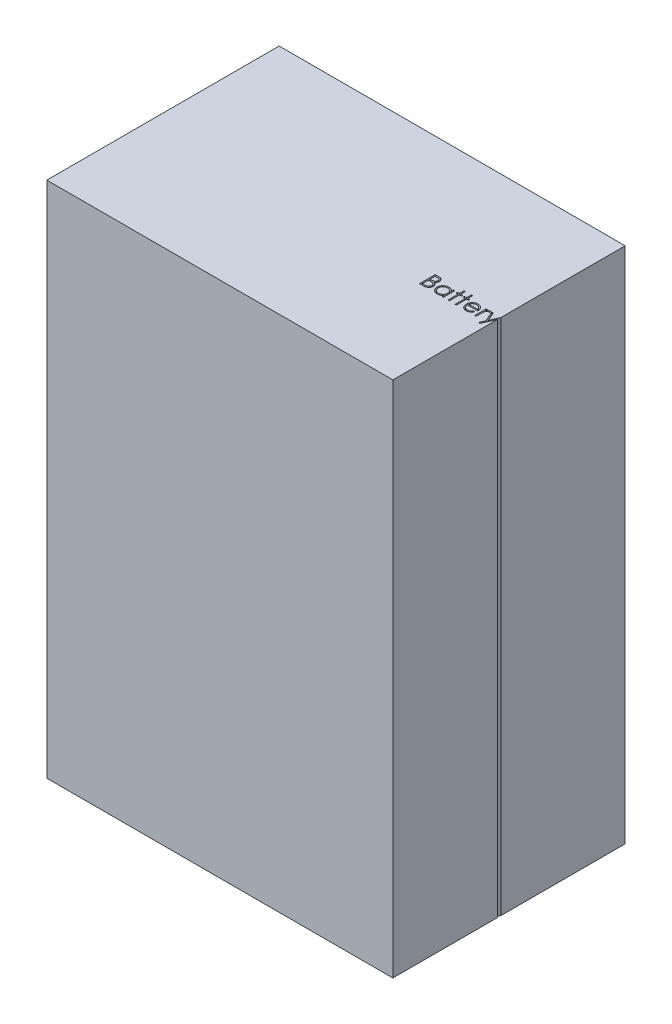
from build123d import *

# Parameters (mm, degrees)
SKETCH1_W      = 70
SKETCH1_H      = 104.788679932
EXTRUDE1_DEPTH = 23.5
EXTRUDE2_DEPTH = 113.950951487


with BuildPart() as part:
    # Sketch1 → Extrude1 (new, symmetric)
    with BuildSketch(Plane.XY):
        Rectangle(SKETCH1_W, SKETCH1_H)
    extrude(amount=EXTRUDE1_DEPTH, both=True)

    # Sketch2 → Extrude2 (cut, through all)
    # profile 1 of 7: a face of its own
    with BuildSketch(Plane(origin=(0, 52.394339966, 0), x_dir=(1, 0, 0), z_dir=(0, 1, 0))):
        with BuildLine():
            Line((20.83761968, -0.759237165), (21.45710085, -0.759237165))
            add(Edge.make_bspline(
                [(21.45710085, -0.759237165), (21.487425255, -0.759396596), (21.546201499, -0.759705612), (21.631671993, -0.764498167), (21.711726271, -0.771032924), (21.78638755, -0.781401651), (21.85562133, -0.793912763), (21.919636258, -0.809063696), (21.978228772, -0.827230696), (22.04818104, -0.856119823), (22.127937639, -0.899048697), (22.214296181, -0.962483895), (22.288141456, -1.040074058), (22.351810472, -1.12759761), (22.402430059, -1.223877917), (22.439050779, -1.326620181), (22.462235423, -1.43449919), (22.464619788, -1.508561216), (22.465824808, -1.545990971)],
                knots=[0, 0, 0, 0, 1.001505555, 1.941167018, 2.826882275, 3.653841531, 4.429895133, 5.150066043, 5.825578002, 6.45369114, 7.647487171, 8.808567382, 9.977351308, 11.170798116, 12.373658725, 13.556498008, 14.765093433, 16, 16, 16, 16], degree=3))
            add(Edge.make_bspline(
                [(22.465824808, -1.545990971), (22.464833103, -1.581054361), (22.462884308, -1.649957228), (22.444249091, -1.750735456), (22.41507477, -1.846666919), (22.374520723, -1.937401511), (22.321813912, -2.020889146), (22.25934958, -2.097803309), (22.183987052, -2.164887482), (22.127523541, -2.202391401), (22.098842636, -2.221441692)],
                knots=[0, 0, 0, 0, 1.044552857, 2.05264487, 3.044412934, 4.028983338, 5.005914585, 5.980388656, 6.974128949, 8, 8, 8, 8], degree=3))
            add(Edge.make_bspline(
                [(22.098842636, -2.221441692), (22.134911024, -2.235289227), (22.203918785, -2.261782991), (22.298883954, -2.308623733), (22.380703563, -2.359570791), (22.450006688, -2.41520754), (22.509277275, -2.475177676), (22.561032444, -2.54036053), (22.605193404, -2.611606403), (22.643032985, -2.688172467), (22.672559357, -2.769276906), (22.694671784, -2.854158967), (22.707342256, -2.942514278), (22.709145331, -3.002644587), (22.710055577, -3.033000186)],
                knots=[0, 0, 0, 0, 1.27268992, 2.434971085, 3.483601985, 4.442670788, 5.356604649, 6.2567628, 7.179492994, 8.113709626, 9.066344395, 10.018646069, 10.999752585, 12, 12, 12, 12], degree=3))
            add(Edge.make_bspline(
                [(22.710055577, -3.033000186), (22.709169438, -3.06399442), (22.707425935, -3.124976443), (22.694562675, -3.214561458), (22.672782985, -3.300173017), (22.642782731, -3.382364861), (22.603628346, -3.460977983), (22.555977978, -3.536101444), (22.499162202, -3.606980444), (22.435605171, -3.674402588), (22.363703082, -3.735024938), (22.286128076, -3.789014186), (22.2019032, -3.833415257), (22.112411748, -3.870713362), (22.016649833, -3.899204178), (21.915047468, -3.919136441), (21.80769228, -3.932566725), (21.734023434, -3.933670903), (21.696243478, -3.934237165)],
                knots=[0, 0, 0, 0, 0.978564426, 1.925352924, 2.850884081, 3.763762016, 4.682927383, 5.618979971, 6.567305752, 7.547517671, 8.540179244, 9.531824382, 10.526200242, 11.540722885, 12.589160233, 13.674978461, 14.80764778, 16, 16, 16, 16], degree=3))
            Line((21.696243478, -3.934237165), (20.83761968, -3.934237165))
            Line((20.83761968, -3.934237165), (20.83761968, -0.759237165))
        make_face()
        with BuildLine():
            Line((21.122555577, -1.08487819), (21.122555577, -2.102506396))
            Line((21.122555577, -2.102506396), (21.313996883, -2.102506396))
            add(Edge.make_bspline(
                [(21.313996883, -2.102506396), (21.341981148, -2.102143608), (21.396052449, -2.101442629), (21.474356927, -2.099434653), (21.547041765, -2.093812142), (21.613981499, -2.088191247), (21.675070716, -2.079052157), (21.730174076, -2.068173589), (21.780156375, -2.056668382), (21.83779582, -2.037101776), (21.90317628, -2.00818417), (21.972874882, -1.963306148), (22.034319722, -1.909853342), (22.086205742, -1.848175826), (22.128670433, -1.780261501), (22.158165018, -1.707193973), (22.178165054, -1.630794282), (22.179971658, -1.578344867), (22.18088891, -1.55171513)],
                knots=[0, 0, 0, 0, 1.156816544, 2.235205308, 3.236616184, 4.169592532, 5.011045266, 5.787822928, 6.49130361, 7.128639758, 8.301311294, 9.436451833, 10.541879658, 11.654887649, 12.756523258, 13.837046038, 14.901820046, 16, 16, 16, 16], degree=3))
            add(Edge.make_bspline(
                [(22.18088891, -1.55171513), (22.18041159, -1.53409318), (22.179475273, -1.499525801), (22.17180692, -1.449134601), (22.158773478, -1.401742054), (22.142032797, -1.356698682), (22.118638773, -1.315412933), (22.091094774, -1.276457319), (22.057815612, -1.241158469), (22.019935764, -1.208166138), (21.976385085, -1.178915745), (21.927189556, -1.153297339), (21.871683592, -1.132668206), (21.810802645, -1.11460141), (21.743609587, -1.101912029), (21.670879813, -1.091340742), (21.592017604, -1.085958897), (21.537457404, -1.085246461), (21.509254295, -1.08487819)],
                knots=[0, 0, 0, 0, 0.91205012, 1.789085906, 2.630437955, 3.453916878, 4.269457761, 5.079663411, 5.91843418, 6.774407191, 7.675494373, 8.627863946, 9.638891023, 10.736472738, 11.911756761, 13.175263542, 14.539845004, 16, 16, 16, 16], degree=3))
            Line((21.509254295, -1.08487819), (21.122555577, -1.08487819))
        make_face(mode=Mode.SUBTRACT)
        with BuildLine():
            Line((21.122555577, -2.428147421), (21.122555577, -3.608596139))
            Line((21.122555577, -3.608596139), (21.528334824, -3.608596139))
            add(Edge.make_bspline(
                [(21.528334824, -3.608596139), (21.557380564, -3.608248025), (21.613362398, -3.607577082), (21.694189943, -3.605386736), (21.769104616, -3.600404458), (21.837764567, -3.592561437), (21.900911192, -3.584053844), (21.957786966, -3.57261361), (22.008852934, -3.559506339), (22.068066056, -3.539246054), (22.134744239, -3.507771398), (22.206599801, -3.460314921), (22.270486442, -3.403778778), (22.324738356, -3.338345734), (22.369200138, -3.267197316), (22.401544729, -3.191772606), (22.421493578, -3.113317878), (22.423908546, -3.059826646), (22.42511968, -3.033000186)],
                knots=[0, 0, 0, 0, 1.160039823, 2.235823828, 3.228722157, 4.157150951, 4.99529583, 5.772374946, 6.472645482, 7.099169577, 8.269452708, 9.405989375, 10.527446681, 11.663510218, 12.788923519, 13.866172445, 14.929861265, 16, 16, 16, 16], degree=3))
            add(Edge.make_bspline(
                [(22.42511968, -3.033000186), (22.424869214, -3.016224084), (22.424372322, -2.98294248), (22.416878764, -2.93403313), (22.405980468, -2.886656802), (22.391891238, -2.840684852), (22.37137215, -2.796948432), (22.347417642, -2.754582539), (22.319331227, -2.713531168), (22.275566877, -2.661631481), (22.211910862, -2.601835334), (22.121462573, -2.543290599), (22.018617703, -2.496075803), (21.94402562, -2.476028421), (21.905493277, -2.465672461)],
                knots=[0, 0, 0, 0, 0.723448775, 1.435228256, 2.130040452, 2.821711965, 3.505591119, 4.210454504, 4.921174351, 5.648778258, 7.137944449, 8.670945889, 10.280296675, 12, 12, 12, 12], degree=3))
            add(Edge.make_bspline(
                [(21.905493277, -2.465672461), (21.890045455, -2.462538207), (21.856551389, -2.455742496), (21.801934512, -2.448569079), (21.73958126, -2.442178203), (21.66934765, -2.437450939), (21.591144822, -2.432564574), (21.504805761, -2.430664272), (21.410683054, -2.428397086), (21.345375687, -2.428232772), (21.311452813, -2.428147421)],
                knots=[0, 0, 0, 0, 0.634451884, 1.375622551, 2.216452059, 3.157844607, 4.20941857, 5.370758133, 6.634282058, 8, 8, 8, 8], degree=3))
            Line((21.311452813, -2.428147421), (21.122555577, -2.428147421))
        make_face(mode=Mode.SUBTRACT)
    # profile 2 of 7: a face of its own
    with BuildSketch(Plane(origin=(0, 52.394339966, 0), x_dir=(1, 0, 0), z_dir=(0, 1, 0))):
        with BuildLine():
            Line((25.640824808, -1.614044857), (25.640824808, -3.934237165))
            Line((25.640824808, -3.934237165), (25.35588891, -3.934237165))
            Line((25.35588891, -3.934237165), (25.35588891, -3.532910041))
            add(Edge.make_bspline(
                [(25.35588891, -3.532910041), (25.323759008, -3.569231673), (25.261057098, -3.640113794), (25.156335512, -3.732716908), (25.045330094, -3.809260099), (24.92857961, -3.871081809), (24.806189489, -3.917520317), (24.678431038, -3.950527761), (24.545252143, -3.971749312), (24.454308935, -3.973868417), (24.408222644, -3.974942293)],
                knots=[0, 0, 0, 0, 1.074387032, 2.096679803, 3.090159297, 4.057316773, 5.018401886, 5.985159533, 6.978961417, 8, 8, 8, 8], degree=3))
            add(Edge.make_bspline(
                [(24.408222644, -3.974942293), (24.367248858, -3.973829798), (24.286446736, -3.971635909), (24.167584645, -3.954615819), (24.053200961, -3.927283041), (23.943187599, -3.889272949), (23.838256438, -3.838853203), (23.737509065, -3.778490785), (23.641467409, -3.706608032), (23.55159537, -3.624431749), (23.468834912, -3.53517344), (23.396207901, -3.439972836), (23.335653321, -3.339241604), (23.285016534, -3.2342551), (23.246012707, -3.124205137), (23.218822339, -3.009472278), (23.201822076, -2.890192178), (23.199629094, -2.808967039), (23.198517116, -2.767780835)],
                knots=[0, 0, 0, 0, 1.033919861, 2.038935746, 3.024066025, 3.998881131, 4.97069526, 5.957263378, 6.95902576, 7.993208707, 9.027059324, 10.027763471, 11.009749337, 11.988697705, 12.965288445, 13.950418724, 14.960734635, 16, 16, 16, 16], degree=3))
            add(Edge.make_bspline(
                [(23.198517116, -2.767780835), (23.19965374, -2.727445904), (23.201900784, -2.647705921), (23.218640491, -2.530431673), (23.246790048, -2.417475822), (23.286294167, -2.309202024), (23.336950798, -2.205479264), (23.398571277, -2.106234184), (23.471160054, -2.011193374), (23.554846166, -1.922591618), (23.645501279, -1.840748632), (23.742482771, -1.769620427), (23.843378176, -1.708191571), (23.949752479, -1.659520203), (24.060031209, -1.620141944), (24.175196121, -1.592897752), (24.294768053, -1.576843753), (24.375948714, -1.57451896), (24.417126891, -1.573339729)],
                knots=[0, 0, 0, 0, 1.020392517, 2.01726096, 2.990465484, 3.961182959, 4.928053699, 5.906110375, 6.912531644, 7.948652711, 8.985773172, 9.998621852, 10.987621588, 11.969261332, 12.953316658, 13.946091881, 14.958173133, 16, 16, 16, 16], degree=3))
            add(Edge.make_bspline(
                [(24.417126891, -1.573339729), (24.464479621, -1.574643975), (24.557336088, -1.57720154), (24.693160782, -1.598485585), (24.821652558, -1.634443338), (24.943803292, -1.683354211), (25.059174343, -1.748349844), (25.166673479, -1.83033738), (25.267425739, -1.928799742), (25.32582786, -2.004428645), (25.35588891, -2.043356756)],
                knots=[0, 0, 0, 0, 1.038897134, 2.037228247, 3.008116434, 3.962042015, 4.918381754, 5.904844433, 6.921570401, 8, 8, 8, 8], degree=3))
            Line((25.35588891, -2.043356756), (25.35588891, -1.614044857))
            Line((25.35588891, -1.614044857), (25.640824808, -1.614044857))
        make_face()
        with BuildLine():
            add(Edge.make_bspline(
                [(24.420942997, -1.858275626), (24.379292133, -1.859757569), (24.297079953, -1.862682689), (24.176390037, -1.885518645), (24.060898583, -1.923513955), (23.951183216, -1.975476823), (23.848977048, -2.040817177), (23.757633503, -2.119848717), (23.676405482, -2.210415152), (23.608090128, -2.31210778), (23.552400177, -2.421126477), (23.513241512, -2.535085789), (23.487415838, -2.651930304), (23.484777394, -2.731180741), (23.483453013, -2.770960923)],
                knots=[0, 0, 0, 0, 1.031046209, 2.035121221, 3.029706178, 4.034933723, 5.034054252, 6.02443088, 7.017295772, 8.038157696, 9.050218397, 10.03989886, 11.016116709, 12, 12, 12, 12], degree=3))
            add(Edge.make_bspline(
                [(23.483453013, -2.770960923), (23.485144738, -2.810503377), (23.488521556, -2.889433293), (23.512788257, -3.006437102), (23.553500714, -3.120423269), (23.609056014, -3.230424313), (23.678621738, -3.332554175), (23.759256444, -3.424847001), (23.851739913, -3.504212556), (23.954181295, -3.570649497), (24.063589954, -3.624318356), (24.178646449, -3.661661472), (24.29718792, -3.685771315), (24.37778968, -3.688587519), (24.418398926, -3.690006396)],
                knots=[0, 0, 0, 0, 0.979072187, 1.954306742, 2.945804271, 3.96968567, 4.997920485, 5.998718438, 6.996577872, 8.005894225, 9.015743152, 10.005417472, 10.995077863, 12, 12, 12, 12], degree=3))
            add(Edge.make_bspline(
                [(24.418398926, -3.690006396), (24.459625397, -3.688500571), (24.541620757, -3.685505636), (24.662668728, -3.662571917), (24.780139159, -3.624681649), (24.892431859, -3.57215887), (24.997040063, -3.507064697), (25.090927424, -3.430858265), (25.170316909, -3.342227519), (25.237620205, -3.244821737), (25.290393619, -3.13804014), (25.328834758, -3.024344124), (25.35156223, -2.903729731), (25.354426742, -2.821303169), (25.35588891, -2.779229152)],
                knots=[0, 0, 0, 0, 1.01762866, 2.023962475, 3.030623092, 4.058876274, 5.077231937, 6.066672613, 7.034107872, 8.005628644, 8.981990164, 9.965428785, 10.961468474, 12, 12, 12, 12], degree=3))
            add(Edge.make_bspline(
                [(25.35588891, -2.779229152), (25.355018365, -2.747172691), (25.353304856, -2.684075433), (25.340214268, -2.591431185), (25.319390871, -2.502772733), (25.290048273, -2.418006865), (25.251502608, -2.337602244), (25.205013564, -2.260981547), (25.14976362, -2.188543277), (25.086642174, -2.12128492), (25.017549455, -2.059938057), (24.944438693, -2.005179068), (24.866443687, -1.960194967), (24.784876089, -1.92296467), (24.699594378, -1.893338156), (24.609904602, -1.873573605), (24.516760092, -1.860002457), (24.453218313, -1.858857297), (24.420942997, -1.858275626)],
                knots=[0, 0, 0, 0, 1.050140795, 2.067009409, 3.05949893, 4.030605086, 5.00011959, 5.97591094, 6.962425594, 7.979863591, 8.993523472, 9.986985069, 10.967611495, 11.937549037, 12.921786183, 13.919465291, 14.943216303, 16, 16, 16, 16], degree=3))
        make_face(mode=Mode.SUBTRACT)
    # profile 3 of 7: a face of its own
    with BuildSketch(Plane(origin=(0, 52.394339966, 0), x_dir=(1, 0, 0), z_dir=(0, 1, 0))):
        Polygon((26.577042757, -0.677826908), (26.861978654, -0.677826908), (26.861978654, -1.614044857), (27.269029936, -1.614044857), (27.269029936, -1.898980755), (26.861978654, -1.898980755), (26.861978654, -3.934237165), (26.577042757, -3.934237165), (26.577042757, -1.898980755), (26.169991475, -1.898980755), (26.169991475, -1.614044857), (26.577042757, -1.614044857), align=None)
    # profile 4 of 7: a face of its own
    with BuildSketch(Plane(origin=(0, 52.394339966, 0), x_dir=(1, 0, 0), z_dir=(0, 1, 0))):
        Polygon((28.042427372, -0.677826908), (28.327363269, -0.677826908), (28.327363269, -1.614044857), (28.734414551, -1.614044857), (28.734414551, -1.898980755), (28.327363269, -1.898980755), (28.327363269, -3.934237165), (28.042427372, -3.934237165), (28.042427372, -1.898980755), (27.63537609, -1.898980755), (27.63537609, -1.614044857), (28.042427372, -1.614044857), align=None)
    # profile 5 of 7: a face of its own
    with BuildSketch(Plane(origin=(0, 52.394339966, 0), x_dir=(1, 0, 0), z_dir=(0, 1, 0))):
        with BuildLine():
            Line((31.127112869, -3.201544857), (31.380247885, -3.334472541))
            add(Edge.make_bspline(
                [(31.380247885, -3.334472541), (31.360076116, -3.370253278), (31.320829843, -3.439868421), (31.253337736, -3.53551018), (31.182587784, -3.621550608), (31.105386328, -3.69569108), (31.024043119, -3.760326265), (30.938107068, -3.816875577), (30.847130783, -3.865061664), (30.751109961, -3.9056586), (30.649238226, -3.936872927), (30.541268707, -3.958920327), (30.426994565, -3.972548578), (30.348666245, -3.97413167), (30.308558181, -3.974942293)],
                knots=[0, 0, 0, 0, 1.120438281, 2.179929193, 3.190490725, 4.156257408, 5.095198341, 6.022838206, 6.959905092, 7.901321166, 8.864066838, 9.862729781, 10.905609505, 12, 12, 12, 12], degree=3))
            add(Edge.make_bspline(
                [(30.308558181, -3.974942293), (30.263979387, -3.973901641), (30.177019075, -3.971871631), (30.05043659, -3.954370609), (29.931256689, -3.925820684), (29.819486073, -3.885937657), (29.715398458, -3.83384287), (29.618786968, -3.770379626), (29.529143541, -3.695873938), (29.449293008, -3.60968045), (29.377407486, -3.517440389), (29.313974778, -3.421323265), (29.260945537, -3.321570911), (29.217808526, -3.218818364), (29.182969827, -3.113713261), (29.158688603, -3.005299287), (29.144691618, -2.893869864), (29.142546728, -2.818488709), (29.141465834, -2.780501187)],
                knots=[0, 0, 0, 0, 1.145258523, 2.234067595, 3.276747158, 4.290159414, 5.277019952, 6.260822364, 7.254936242, 8.264827045, 9.274100331, 10.257902744, 11.220704747, 12.172965371, 13.118907548, 14.062713208, 15.023725156, 16, 16, 16, 16], degree=3))
            add(Edge.make_bspline(
                [(29.141465834, -2.780501187), (29.142426626, -2.744855162), (29.14433079, -2.674209449), (29.156333004, -2.569647133), (29.177603956, -2.468021323), (29.206792478, -2.369247574), (29.244485394, -2.273491266), (29.290597479, -2.180694123), (29.345200564, -2.090954889), (29.387357919, -2.034346332), (29.408593237, -2.005831716)],
                knots=[0, 0, 0, 0, 1.024358464, 2.0301432, 3.019427413, 4.004406732, 4.986367066, 5.972626655, 6.978780325, 8, 8, 8, 8], degree=3))
            add(Edge.make_bspline(
                [(29.408593237, -2.005831716), (29.437356635, -1.971479241), (29.49397228, -1.90386249), (29.589726974, -1.815018438), (29.69341358, -1.740593013), (29.803732698, -1.678900825), (29.9219665, -1.632025445), (30.046525642, -1.597093567), (30.178828424, -1.577519229), (30.269275303, -1.574754408), (30.315554375, -1.573339729)],
                knots=[0, 0, 0, 0, 1.030682036, 2.02871468, 2.997146059, 3.962720338, 4.930598197, 5.918074684, 6.934738563, 8, 8, 8, 8], degree=3))
            add(Edge.make_bspline(
                [(30.315554375, -1.573339729), (30.363131846, -1.574568045), (30.456467997, -1.57697772), (30.592568564, -1.599317323), (30.721347214, -1.634743569), (30.842752415, -1.684775936), (30.956796474, -1.749327815), (31.062738105, -1.829285057), (31.16238912, -1.922192893), (31.220363331, -1.993642376), (31.249864271, -2.030000386)],
                knots=[0, 0, 0, 0, 1.056321875, 2.072262726, 3.055038591, 4.01806755, 4.982017516, 5.957941055, 6.960871419, 8, 8, 8, 8], degree=3))
            add(Edge.make_bspline(
                [(31.249864271, -2.030000386), (31.269936565, -2.057399349), (31.309947546, -2.1120149), (31.360064558, -2.201070164), (31.403568766, -2.294243346), (31.438342238, -2.393040544), (31.4664995, -2.496291163), (31.486871043, -2.604733328), (31.498817768, -2.718334748), (31.501166086, -2.795738123), (31.502363269, -2.835198703)],
                knots=[0, 0, 0, 0, 0.94817472, 1.890038105, 2.849395472, 3.817997239, 4.812318967, 5.836947057, 6.897266129, 8, 8, 8, 8], degree=3))
            Line((31.502363269, -2.835198703), (29.426401731, -2.835198703))
            add(Edge.make_bspline(
                [(29.426401731, -2.835198703), (29.427798374, -2.865769839), (29.430544816, -2.925886744), (29.443349267, -3.013853097), (29.463532084, -3.097648914), (29.49189759, -3.176645674), (29.526248229, -3.251875147), (29.5683267, -3.32277928), (29.618527581, -3.389035117), (29.674521609, -3.451235306), (29.736848759, -3.506626139), (29.802419537, -3.556203108), (29.872172985, -3.597755327), (29.945559104, -3.631482799), (30.022459223, -3.657886386), (30.102897572, -3.675909337), (30.186715863, -3.687980784), (30.243852922, -3.689323052), (30.272941194, -3.690006396)],
                knots=[0, 0, 0, 0, 1.094153842, 2.151609401, 3.174256925, 4.172055639, 5.149267565, 6.128595816, 7.11444997, 8.118368179, 9.117203808, 10.09244225, 11.054858984, 12.015122123, 12.976791628, 13.957293641, 14.960065497, 16, 16, 16, 16], degree=3))
            add(Edge.make_bspline(
                [(30.272941194, -3.690006396), (30.301381164, -3.689454801), (30.357811519, -3.688360332), (30.441850011, -3.677717813), (30.524526582, -3.660509063), (30.605499046, -3.637023144), (30.683124027, -3.608378428), (30.755011062, -3.573813693), (30.821123829, -3.535577851), (30.882915649, -3.491844789), (30.942851479, -3.438315933), (31.002307877, -3.371517815), (31.066058841, -3.292516986), (31.105963686, -3.233057704), (31.127112869, -3.201544857)],
                knots=[0, 0, 0, 0, 0.99110716, 1.966546729, 2.947904876, 3.932708344, 4.903319531, 5.828989031, 6.710028674, 7.56322171, 8.463672341, 9.504779593, 10.677557249, 12, 12, 12, 12], degree=3))
        make_face()
        with BuildLine():
            add(Edge.make_bspline(
                [(31.217427372, -2.550262806), (31.206998291, -2.512468628), (31.186925668, -2.439727), (31.14498268, -2.33899705), (31.097746354, -2.249473025), (31.04184664, -2.171840072), (30.978511082, -2.102894028), (30.905354381, -2.042642883), (30.823316106, -1.988742767), (30.732820314, -1.943247285), (30.636988123, -1.904521485), (30.536652506, -1.878554416), (30.43427437, -1.860765759), (30.365028267, -1.859109218), (30.330182781, -1.858275626)],
                knots=[0, 0, 0, 0, 1.154881502, 2.222775134, 3.210006277, 4.132804581, 5.035138423, 5.962687519, 6.919655026, 7.923214229, 8.944639381, 9.960483929, 10.97369054, 12, 12, 12, 12], degree=3))
            add(Edge.make_bspline(
                [(30.330182781, -1.858275626), (30.301744361, -1.8588305), (30.245527586, -1.859927368), (30.162704474, -1.870332414), (30.083166461, -1.887531702), (30.006326664, -1.911085627), (29.93319202, -1.942480573), (29.862258194, -1.979295357), (29.795328835, -2.024236651), (29.753472088, -2.058489327), (29.73232621, -2.075793655)],
                knots=[0, 0, 0, 0, 1.04873581, 2.073130211, 3.073294108, 4.04793562, 5.032784715, 6.005352987, 6.992311501, 8, 8, 8, 8], degree=3))
            add(Edge.make_bspline(
                [(29.73232621, -2.075793655), (29.717183019, -2.089486356), (29.68653689, -2.117197045), (29.645587988, -2.164939253), (29.606380845, -2.216421028), (29.570699603, -2.273611962), (29.537972078, -2.335860812), (29.507346956, -2.402642524), (29.479782139, -2.474463863), (29.464273525, -2.524513147), (29.45629456, -2.550262806)],
                knots=[0, 0, 0, 0, 0.879870761, 1.780643979, 2.707998968, 3.669668524, 4.684282772, 5.740141944, 6.837334558, 8, 8, 8, 8], degree=3))
            Line((29.45629456, -2.550262806), (31.217427372, -2.550262806))
        make_face(mode=Mode.SUBTRACT)
    # profile 6 of 7: a face of its own
    with BuildSketch(Plane(origin=(0, 52.394339966, 0), x_dir=(1, 0, 0), z_dir=(0, 1, 0))):
        with BuildLine():
            Line((31.990824808, -1.614044857), (32.275760705, -1.614044857))
            Line((32.275760705, -1.614044857), (32.275760705, -1.955586323))
            add(Edge.make_bspline(
                [(32.275760705, -1.955586323), (32.296796222, -1.923785679), (32.337026485, -1.862967194), (32.403894642, -1.782531471), (32.47238695, -1.715933536), (32.542831298, -1.662862487), (32.615745717, -1.623117729), (32.689529952, -1.594004761), (32.765344843, -1.576789626), (32.816291731, -1.574491235), (32.841816394, -1.573339729)],
                knots=[0, 0, 0, 0, 1.2804753, 2.448899062, 3.506932113, 4.484331642, 5.4025378, 6.288909075, 7.142734305, 8, 8, 8, 8], degree=3))
            add(Edge.make_bspline(
                [(32.841816394, -1.573339729), (32.861615991, -1.574419707), (32.902354946, -1.576641831), (32.964024867, -1.592254508), (33.027564284, -1.617180999), (33.068514878, -1.640621773), (33.089863269, -1.652841932)],
                knots=[0, 0, 0, 0, 0.901110191, 1.854092781, 2.881294221, 4, 4, 4, 4], degree=3))
            Line((33.089863269, -1.652841932), (32.933402933, -1.899616772))
            add(Edge.make_bspline(
                [(32.933402933, -1.899616772), (32.919696892, -1.893502388), (32.893680203, -1.881896116), (32.855621418, -1.86816015), (32.82053192, -1.86007214), (32.798176692, -1.858846847), (32.787754896, -1.858275626)],
                knots=[0, 0, 0, 0, 1.180555205, 2.24091978, 3.179933427, 4, 4, 4, 4], degree=3))
            add(Edge.make_bspline(
                [(32.787754896, -1.858275626), (32.764889695, -1.85979966), (32.718251313, -1.862908248), (32.649776088, -1.887345595), (32.583330409, -1.926829205), (32.530560401, -1.970618), (32.489700643, -2.012843502), (32.460544867, -2.04971741), (32.433799804, -2.09106374), (32.408245389, -2.136175667), (32.384962394, -2.185823456), (32.363232087, -2.239511085), (32.343584404, -2.297300738), (32.332380968, -2.337562024), (32.326642116, -2.358185482)],
                knots=[0, 0, 0, 0, 1.125678352, 2.296057538, 3.5422874, 4.923748041, 5.663163013, 6.437101912, 7.23742474, 8.08941207, 8.991984279, 9.93940061, 10.944477711, 12, 12, 12, 12], degree=3))
            add(Edge.make_bspline(
                [(32.326642116, -2.358185482), (32.322349159, -2.376579775), (32.312840586, -2.417321737), (32.303595405, -2.485673613), (32.294460914, -2.566430789), (32.288023267, -2.659818055), (32.282056043, -2.765602201), (32.278690468, -2.88394438), (32.275875477, -3.014966063), (32.275800123, -3.106564226), (32.275760705, -3.154479553)],
                knots=[0, 0, 0, 0, 0.566838948, 1.255505196, 2.06880316, 3.007127437, 4.065329342, 5.249902469, 6.561414163, 8, 8, 8, 8], degree=3))
            Line((32.275760705, -3.154479553), (32.275760705, -3.934237165))
            Line((32.275760705, -3.934237165), (31.990824808, -3.934237165))
            Line((31.990824808, -3.934237165), (31.990824808, -1.614044857))
        make_face()
    # profile 7 of 7: a face of its own
    with BuildSketch(Plane(origin=(0, 52.394339966, 0), x_dir=(1, 0, 0), z_dir=(0, 1, 0))):
        Polygon((33.130568398, -1.614044857), (33.437764912, -1.614044857), (34.223246683, -3.39107811), (35.020812789, -1.614044857), (35.328645321, -1.614044857), (33.903965834, -4.789044857), (33.596133301, -4.789044857), (34.068694399, -3.736435682), align=None)
    extrude(amount=-EXTRUDE2_DEPTH, mode=Mode.SUBTRACT)


with BuildPart() as extrude2_piece_1:
    # of the separate pieces the step leaves, piece 1, a body of its own (extrude2_pieces)
    add(part.part.solids().sort_by_distance((-35, -52.394339966, 23.5))[0])


with BuildPart() as extrude2_piece_2:
    # of the separate pieces the step leaves, piece 2, a body of its own (extrude2_pieces)
    add(part.part.solids().sort_by_distance((24.418398926, -52.394339966, 3.690006396))[0])


with BuildPart() as extrude2_piece_3:
    # of the separate pieces the step leaves, piece 3, a body of its own (extrude2_pieces)
    add(part.part.solids().sort_by_distance((21.528334824, -52.394339966, 3.608596139))[0])


with BuildPart() as extrude2_piece_4:
    # of the separate pieces the step leaves, piece 4, a body of its own (extrude2_pieces)
    add(part.part.solids().sort_by_distance((21.313996883, -52.394339966, 2.102506396))[0])


with BuildPart() as extrude2_piece_5:
    # of the separate pieces the step leaves, piece 5, a body of its own (extrude2_pieces)
    add(part.part.solids().sort_by_distance((29.73232621, -52.394339966, 2.075793655))[0])


solid = Compound([extrude2_piece_1.part, extrude2_piece_2.part, extrude2_piece_3.part, extrude2_piece_4.part, extrude2_piece_5.part])
